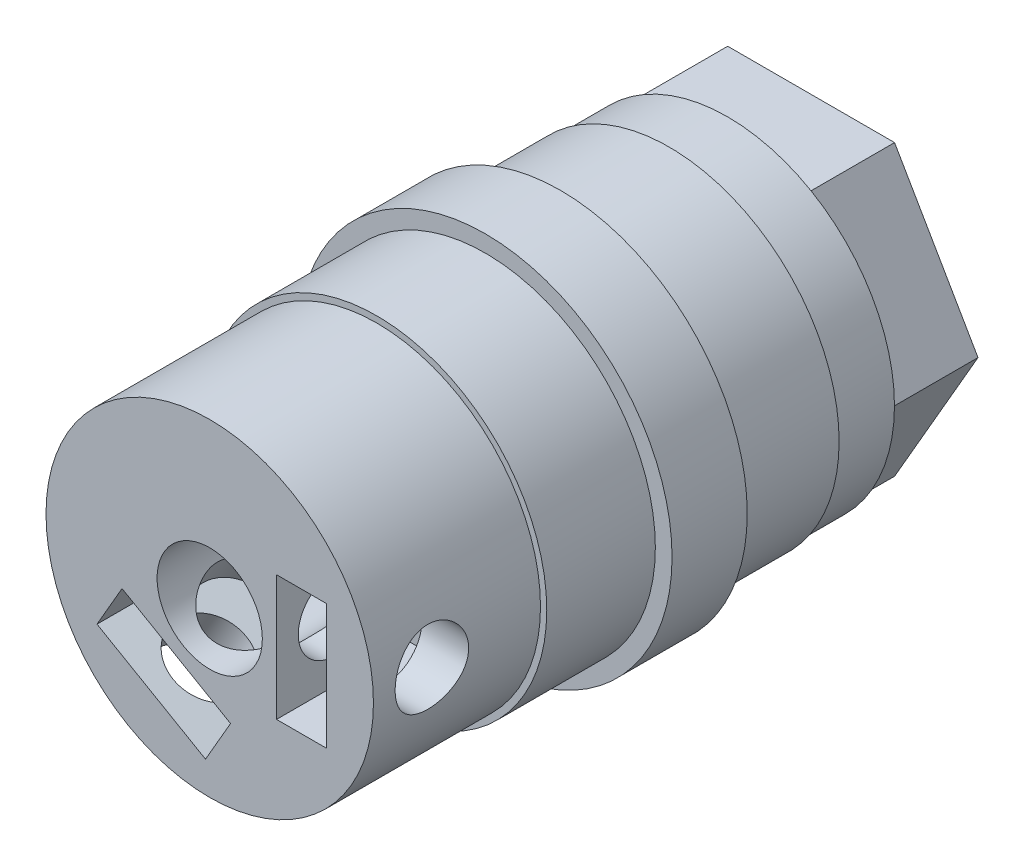
from build123d import *

# Parameters (mm, degrees)
SKETCH_2_R               = 1.75
EXTRUDE_937_DEPTH        = 5
FILLET_1_R               = 1
SKETCH_9_W               = 3
SKETCH_9_H               = 7.5
CUT_EXTRUDE_1306_DEPTH   = 8
CUT_EXTRUDE_2_DEPTH      = 10
CUT_EXTRUDE_2_DEPTH_BACK = 5
SKETCH_12_R              = 2.2
CUT_EXTRUDE_START        = -10
SKETCH_15_R              = 10.175
SKETCH_15_R_2            = 9.8
CUT_EXTRUDE_1_DEPTH      = 10
SKETCH_16_R              = 2.2
CUT_EXTRUDE_1_2_DEPTH    = 41.324759764
SKETCH_18_R              = 10.175
SKETCH_18_R_2            = 9.988159657
CUT_EXTRUDE_2_2_DEPTH    = 3.5


with BuildPart() as part:
    # Эскиз1 → Revolve 727 (revolve)
    with BuildSketch(Plane(origin=(0, 0, 0), x_dir=(0, 0, -1), z_dir=(1, 0, 0)), mode=Mode.PRIVATE) as revolve_727_sk:
        Polygon((0, 0), (0, 7.025), (16.5, 7.025), (16.5, 8.025), (21, 8.025), (21, 7.025), (31, 7.025), (31, -1.4), (14.5, -1.4), (14.5, 0), align=None)
    revolve(revolve_727_sk.sketch.rotate(Axis((0, -3.15, 0), (0, 0, -1)), 90), axis=Axis((0, -3.15, 0), (0, 0, -1)))

    # Эскиз2 → Extrude 937 (add)
    with BuildSketch(Plane(origin=(0, 0, -31), x_dir=(-1, 0, 0), z_dir=(0, 0, -1))):
        Polygon((4.994079828, 5.5), (-4.994079828, 5.5), (-9.988159657, -3.15), (-4.994079828, -11.8), (4.994079828, -11.8), (9.988159657, -3.15), align=None)
        with Locations(Location((0, -3.15, 0), (0, 0, 180))):
            Circle(SKETCH_2_R, mode=Mode.SUBTRACT)
    extrude(amount=EXTRUDE_937_DEPTH)

    # Скругление1
    fillet_1_edges = [part.edges().sort_by_distance(p)[0] for p in [
        (-3.15, -3.15, -14.5),
    ]]
    fillet(fillet_1_edges, radius=FILLET_1_R)

    # Эскиз9 → Cut-Extrude 1306 (cut)
    with BuildSketch(Plane.XY):
        with Locations((5.5, -3.15)):
            Rectangle(SKETCH_9_W, SKETCH_9_H)
        Polygon((-6.747595264, -7.337177826), (-5.247595264, -4.739101615), (1.247595264, -8.489101615), (-0.252404736, -11.087177826), align=None)
    extrude(amount=-CUT_EXTRUDE_1306_DEPTH, mode=Mode.SUBTRACT)

    # Эскиз12 → Cut-Extrude 2 (cut, two sides: drawn at the far end of the back side and taken through both)
    with BuildSketch(Plane(origin=(-3.363990011, -5.826601615, 0), x_dir=(0.8660254037844364, -0.500000000000004, 0), z_dir=(-0.500000000000004, -0.8660254037844365, 0)).offset(-CUT_EXTRUDE_2_DEPTH_BACK)):
        with Locations(Location((1.575, -3.5, 0), (0, 0, 180))):
            Circle(SKETCH_12_R)
    extrude(amount=CUT_EXTRUDE_2_DEPTH + CUT_EXTRUDE_2_DEPTH_BACK, mode=Mode.SUBTRACT)

    # Эскиз15 → Cut-Extrude 1 (cut)
    with BuildSketch(Plane.XY.offset(CUT_EXTRUDE_START)):
        with Locations((0, -3.15)):
            Circle(SKETCH_15_R)
        with Locations((0, -3.15)):
            Circle(SKETCH_15_R_2, mode=Mode.SUBTRACT)
    extrude(amount=CUT_EXTRUDE_1_DEPTH, mode=Mode.SUBTRACT)

    # Эскиз16 → Cut-Extrude 1 2 (cut, through all)
    with BuildSketch(Plane(origin=(0, 0, 0), x_dir=(0, 0, -1), z_dir=(1, 0, 0))):
        with Locations(Location((3.5, -3.15, 0), (0, 0, 180))):
            Circle(SKETCH_16_R)
    extrude(amount=CUT_EXTRUDE_1_2_DEPTH, mode=Mode.SUBTRACT)

    # Эскиз18 → Cut-Extrude 2 2 (cut)
    with BuildSketch(Plane(origin=(0, 0, -31), x_dir=(-1, 0, 0), z_dir=(0, 0, -1))):
        with Locations(Location((0, -3.15, 0), (0, 0, 180))):
            Circle(SKETCH_18_R)
        with Locations((0, -3.15)):
            Circle(SKETCH_18_R_2, mode=Mode.SUBTRACT)
    extrude(amount=-CUT_EXTRUDE_2_2_DEPTH, mode=Mode.SUBTRACT)


solid = part.part
